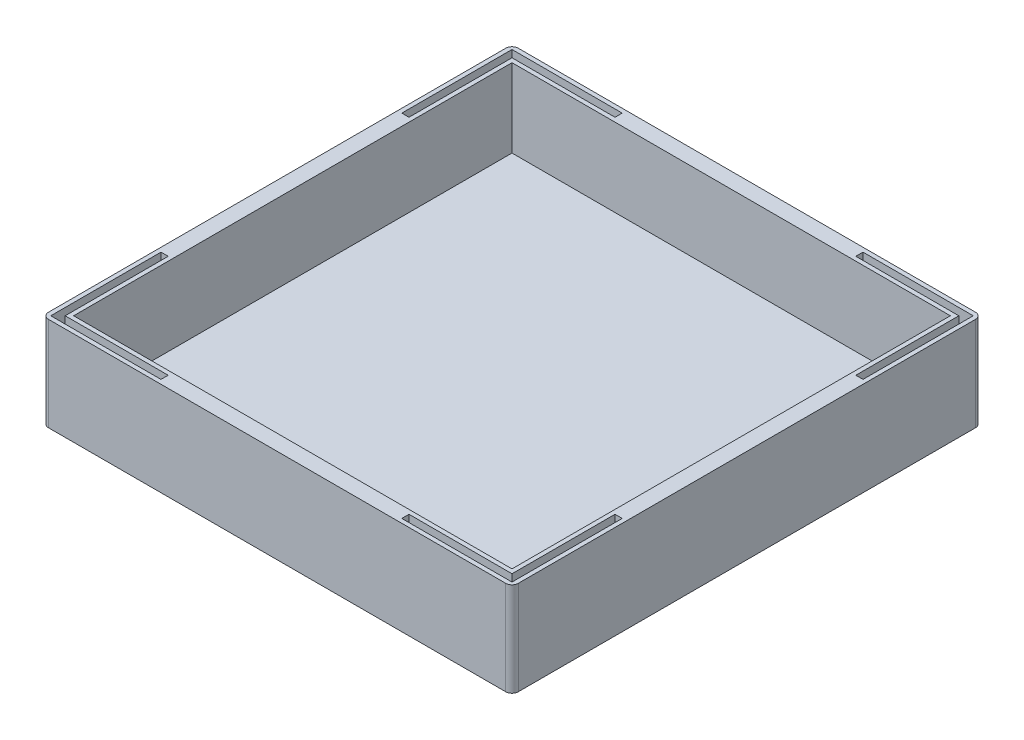
from build123d import *

# Parameters (mm, degrees)
SKETCH3_W           = 150
SKETCH3_H           = 150
BOSS_EXTRUDE1_DEPTH = 30
SHELL1_T            = -5
CUT_EXTRUDE1_DEPTH  = 20
FILLET2_R           = 2


with BuildPart() as part:
    # Sketch3 → Boss-Extrude1 (new body)
    with BuildSketch(Plane(origin=(0, 0, 0), x_dir=(1, 0, 0), z_dir=(0, 1, 0))):
        with Locations((75, 75)):
            Rectangle(SKETCH3_W, SKETCH3_H)
    extrude(amount=BOSS_EXTRUDE1_DEPTH)

    # Shell1
    shell1_openings = [part.faces().sort_by_distance(p)[0] for p in [
        (75, 30, -75),
    ]]
    offset(amount=SHELL1_T, openings=shell1_openings, kind=Kind.INTERSECTION)

    # Sketch5 → Cut-Extrude1 (cut)
    with BuildSketch(Plane(origin=(0, 30, 0), x_dir=(1, 0, 0), z_dir=(0, 1, 0))):
        Polygon((1.35, 148.65), (36.55, 148.65), (36.55, 146.35), (3.65, 146.35), (3.65, 113.45), (1.35, 113.45), align=None)
        Polygon((148.65, 113.45), (148.65, 148.65), (113.45, 148.65), (113.45, 146.35), (146.35, 146.35), (146.35, 113.45), align=None)
        Polygon((148.65, 1.35), (113.45, 1.35), (113.45, 3.65), (146.35, 3.65), (146.35, 36.55), (148.65, 36.55), align=None)
        Polygon((1.35, 36.55), (1.35, 1.35), (36.55, 1.35), (36.55, 3.65), (3.65, 3.65), (3.65, 36.55), align=None)
    extrude(amount=-CUT_EXTRUDE1_DEPTH, mode=Mode.SUBTRACT)

    # Fillet2
    fillet2_edges = [part.edges().sort_by_distance(p)[0] for p in [
        (0, 15, -150),
        (150, 15, -150),
        (150, 15, 0),
        (0, 15, 0),
    ]]
    fillet(fillet2_edges, radius=FILLET2_R)


solid = part.part
